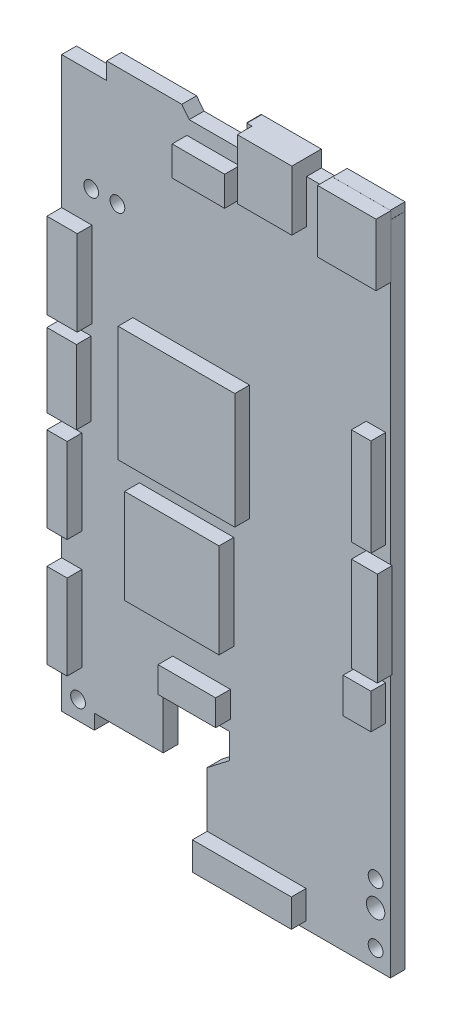
from build123d import *

# Parameters (mm, degrees)
BOSS_EXTRU_1_DEPTH  = 2
ESQUISSE3_W         = 15.79325035
ESQUISSE3_H         = 15.667907094
BOSS_EXTRU_3_DEPTH  = 2
ESQUISSE4_W         = 12.785012189
ESQUISSE4_H         = 12.785012188
BOSS_EXTRU_4_DEPTH  = 2
ESQUISSE5_W         = 7.91948101
ESQUISSE5_H         = 8.397998202
BOSS_EXTRU_5_DEPTH  = 2
ESQUISSE6_W         = 7.37870607
ESQUISSE6_H         = 8.10533589
BOSS_EXTRU_6_DEPTH  = 2
ESQUISSE7_W         = 2.632934746
ESQUISSE7_H         = 13.164673727
ESQUISSE7_W_2       = 3.510579661
ESQUISSE7_H_2       = 12.788540192
ESQUISSE7_W_3       = 3.761335351
ESQUISSE7_H_3       = 4.764358111
ESQUISSE7_W_4       = 7.8
ESQUISSE7_H_4       = 3.5
ESQUISSE7_W_5       = 13.4
ESQUISSE7_H_5       = 3.8
ESQUISSE7_W_6       = 2.742200186
ESQUISSE7_H_6       = 11.5
ESQUISSE7_W_7       = 4
ESQUISSE7_H_7       = 10
ESQUISSE7_W_8       = 7.11
ESQUISSE7_H_8       = 4
ESQUISSE7_W_9       = 4.11
ESQUISSE7_H_9       = 11.55
BOSS_EXTRU_7_DEPTH  = 2
SKETCH_3_R          = 1
SKETCH_3_R_2        = 1.25
CUT_EXTRUDE_4_DEPTH = 10
SKETCH_1_R          = 1
CUT_EXTRUDE_5_DEPTH = 10
SKETCH_2_R          = 1
CUT_EXTRUDE_6_DEPTH = 10


with BuildPart() as part:
    # Esquisse1 → Boss.-Extru.1 (new body)
    with BuildSketch(Plane.XY):
        Polygon((778.796370306, 167.014727296), (753.996370306, 167.014727296), (753.996370306, 179.284727296), (757.046370306, 181.630881142), (757.046370306, 185.030881142), (748.046370306, 185.030881142), (748.046370306, 178.030881142), (738.734755108, 178.030881142), (738.734755108, 176.030881142), (734.296370306, 176.030881142), (734.296370306, 253.030881142), (740.392724327, 253.030881142), (740.392724327, 255.330881142), (750.563009525, 255.330881142), (751.563009525, 254.030881142), (759.363009525, 254.030881142), (759.363009525, 257.573130323), (759.380880171, 257.573130323), (759.380880171, 257.530881142), (767.454666434, 257.530881142), (767.454666434, 255.306621268), (770.951996508, 255.306621268), (770.951996508, 257.014727296), (778.78419371, 257.014727296), (778.78419371, 255.894727296), (778.796370306, 255.894727296), align=None)
    extrude(amount=BOSS_EXTRU_1_DEPTH)

    # Esquisse3 → Boss.-Extru.3 (add)
    with BuildSketch(Plane(origin=(0, 0, 2), x_dir=(-1, 0, 0), z_dir=(0, 0, -1))):
        with Locations((-751.834833735, 219.169546492)):
            Rectangle(ESQUISSE3_W, ESQUISSE3_H)
    extrude(amount=-BOSS_EXTRU_3_DEPTH)

    # Esquisse4 → Boss.-Extru.4 (add)
    with BuildSketch(Plane(origin=(0, 0, 2), x_dir=(-1, 0, 0), z_dir=(0, 0, -1))):
        with Locations((-751.208117452, 201.684162176)):
            Rectangle(ESQUISSE4_W, ESQUISSE4_H)
    extrude(amount=-BOSS_EXTRU_4_DEPTH)

    # Esquisse5 → Boss.-Extru.5 (add)
    with BuildSketch(Plane(origin=(0, 0, 2), x_dir=(-1, 0, 0), z_dir=(0, 0, -1))):
        with Locations((-774.900958926, 252.812156779)):
            Rectangle(ESQUISSE5_W, ESQUISSE5_H)
    extrude(amount=-BOSS_EXTRU_5_DEPTH)

    # Esquisse6 → Boss.-Extru.6 (add)
    with BuildSketch(Plane(origin=(0, 0, 2), x_dir=(-1, 0, 0), z_dir=(0, 0, -1))):
        with Locations((-763.765313399, 253.478213197)):
            Rectangle(ESQUISSE6_W, ESQUISSE6_H)
    extrude(amount=-BOSS_EXTRU_6_DEPTH)

    # Esquisse7 → Boss.-Extru.7 (add)
    with BuildSketch(Plane(origin=(0, 0, 2), x_dir=(-1, 0, 0), z_dir=(0, 0, -1))):
        with Locations((-776.846036285, 224.074096482)):
            Rectangle(ESQUISSE7_W, ESQUISSE7_H)
        with Locations((-777.284858743, 209.091444002)):
            Rectangle(ESQUISSE7_W_2, ESQUISSE7_H_2)
        with Locations((-776.281835983, 198.935838556)):
            Rectangle(ESQUISSE7_W_3, ESQUISSE7_H_3)
        with Locations((-753.246370306, 188.280881142)):
            Rectangle(ESQUISSE7_W_4, ESQUISSE7_H_4)
        with Locations((-760.696370306, 169.914727296)):
            Rectangle(ESQUISSE7_W_5, ESQUISSE7_H_5)
        with Locations((-735.667470399, 188.280881142)):
            Rectangle(ESQUISSE7_W_6, ESQUISSE7_H_6)
        with Locations((-735.667470399, 204.280881142)):
            Rectangle(ESQUISSE7_W_6, ESQUISSE7_H_6)
        with Locations((-736.296370306, 217.030881142)):
            Rectangle(ESQUISSE7_W_7, ESQUISSE7_H_7)
        with Locations((-754.808009525, 250.030881142)):
            Rectangle(ESQUISSE7_W_8, ESQUISSE7_H_8)
        with Locations((-736.351370306, 229.305881142)):
            Rectangle(ESQUISSE7_W_9, ESQUISSE7_H_9)
    extrude(amount=-BOSS_EXTRU_7_DEPTH)

    # Эскиз3 → Вырез-Вытянуть4 (cut)
    with BuildSketch(Plane.XY.offset(2)):
        with Locations((738.296370306, 239.280881142)):
            Circle(SKETCH_3_R)
        with Locations((741.846370306, 239.280881142)):
            Circle(SKETCH_3_R)
        with Locations((776.796370306, 174.214727296)):
            Circle(SKETCH_3_R_2)
        with Locations((776.796370306, 177.614727296)):
            Circle(SKETCH_3_R)
    extrude(amount=-CUT_EXTRUDE_4_DEPTH, mode=Mode.SUBTRACT)

    # Эскиз1 → Вырез-Вытянуть5 (cut)
    with BuildSketch(Plane.XY.offset(2)):
        with Locations((736.515562707, 178.530881142)):
            Circle(SKETCH_1_R)
    extrude(amount=-CUT_EXTRUDE_5_DEPTH, mode=Mode.SUBTRACT)

    # Эскиз2 → Вырез-Вытянуть6 (cut)
    with BuildSketch(Plane.XY.offset(2)):
        with Locations((776.796370306, 169.514727296)):
            Circle(SKETCH_2_R)
    extrude(amount=-CUT_EXTRUDE_6_DEPTH, mode=Mode.SUBTRACT)


solid = part.part
